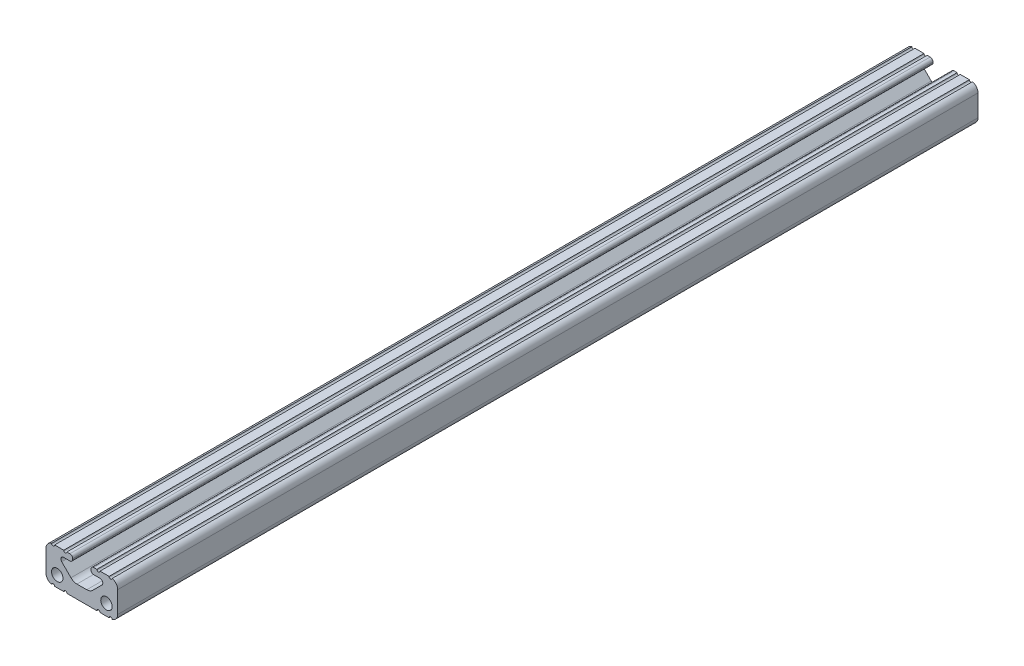
from build123d import *

# Parameters (mm, degrees)
SKETCH3_R               = 2.032
BOSS_EXTRUDE1_DEPTH     = 152.4
CUT_EXTRUDE1_DEPTH      = 154.060029074
CUT_EXTRUDE1_DEPTH_BACK = 154.060029074
SKETCH4_R               = 0.55245


with BuildPart() as part:
    # Sketch3 → Boss-Extrude1 (new, symmetric)
    with BuildSketch(Plane.XY):
        with BuildLine():
            Line((3.2512, 5.35559), (3.2512, 5.13461))
            ThreePointArc((3.2512, 5.13461), (3.542455946, 4.431455946), (4.24561, 4.1402))
            Line((4.24561, 4.1402), (6.42239, 4.1402))
            ThreePointArc((6.42239, 4.1402), (7.341105046, 3.526334232), (7.125544054, 2.442635946))
            Line((7.125544054, 2.442635946), (3.854875946, -0.828032163))
            ThreePointArc((3.854875946, -0.828032163), (2.887046479, -1.474715138), (1.745413783, -1.7018))
            Line((1.745413783, -1.7018), (0, -1.7018))
            Line((0, -1.7018), (0, -6.35))
            Line((0, -6.35), (10.16, -6.35))
            ThreePointArc((10.16, -6.35), (11.956051224, -5.606051224), (12.7, -3.81))
            Line((12.7, -3.81), (12.7, 3.81))
            ThreePointArc((12.7, 3.81), (11.956051224, 5.606051224), (10.16, 6.35))
            Line((10.16, 6.35), (4.24561, 6.35))
            ThreePointArc((4.24561, 6.35), (3.542455946, 6.058744054), (3.2512, 5.35559))
        make_face()
        with Locations(Location((8.7249, -2.3876, 0), (0, 0, 180))):
            Circle(SKETCH3_R, mode=Mode.SUBTRACT)
    extrude(amount=BOSS_EXTRUDE1_DEPTH, both=True)

    # Sketch4 → Cut-Extrude1 (cut, two sides: drawn at the far end of the back side and taken through both)
    with BuildSketch(Plane.XY.offset(-CUT_EXTRUDE1_DEPTH_BACK)):
        with Locations((5.86994, 6.35)):
            Circle(SKETCH4_R)
        with Locations((10.20445, 6.35)):
            Circle(SKETCH4_R)
        with Locations((5.86994, -6.35)):
            Circle(SKETCH4_R)
        with Locations((10.20445, -6.35)):
            Circle(SKETCH4_R)
    extrude(amount=CUT_EXTRUDE1_DEPTH + CUT_EXTRUDE1_DEPTH_BACK, mode=Mode.SUBTRACT)

    # Mirror1: part across plane


with BuildPart() as part_1:
    add(part.part)
    add(part.part.mirror(Plane(origin=(0, 0, 0), x_dir=(0, 0, 1), z_dir=(1, 0, 0))))


solid = part_1.part
